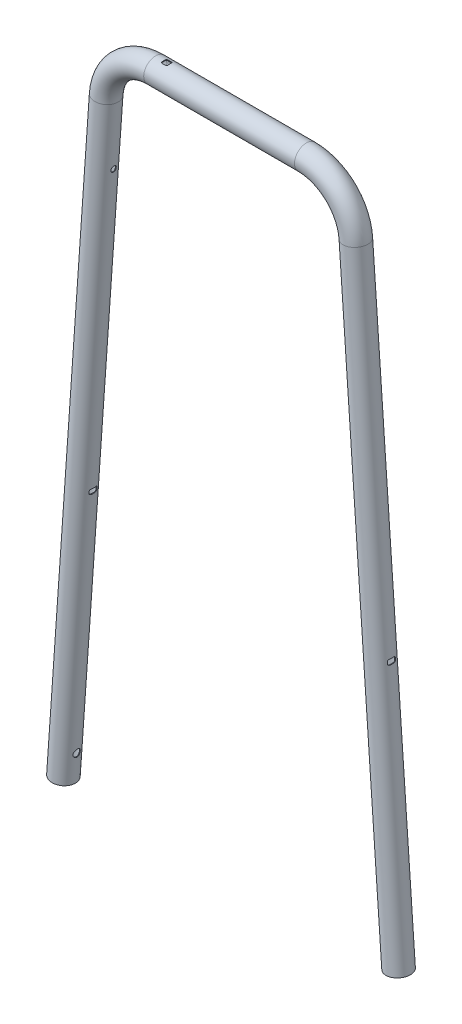
from build123d import *

# Parameters (mm, degrees)
SKETCH2_R                       = 13.2
SKETCH2_R_2                     = 12.4
SKETCH17_R                      = 4.05
CUT_EXTRUDE6_DEPTH              = 50
CUT_EXTRUDE7_DEPTH              = 50
SKETCH19_R                      = 4
CUT_EXTRUDE8_DEPTH              = 50
SKETCH20_R                      = 3.25
CUT_EXTRUDE9_DEPTH              = 50
CUT_EXTRUDE10_DEPTH             = 10
CUT_EXTRUDE11_REACH             = 838.488
SKETCH22_R                      = 3.05
CUT_EXTRUDE11_DIRECTION_2_REACH = 838.488


with BuildPart() as part:
    # Sweep2: sweep along a path in Sketch1
    with BuildLine(Plane.XY) as sweep2_path:
        Line((185.919930924, -162.284032228), (138.5, 515.852573828))
        ThreePointArc((138.5, 515.852573828), (121.143887039, 552.240421361), (83.633977236, 567.015967772))
        Line((83.633977236, 567.015967772), (-83.633977236, 567.015967772))
        ThreePointArc((-83.633977236, 567.015967772), (-121.143887039, 552.240421361), (-138.5, 515.852573828))
        Line((-138.5, 515.852573828), (-185.919930924, -162.284032228))
    # Sketch2 → Sweep2 (sweep)
    with BuildSketch(Plane(origin=(-185.919930924, -162.284032228, 0), x_dir=(-0.9975640502598243, 0.06975647374412519, 0), z_dir=(-0.06975647374412518, -0.9975640502598242, 0))):
        Circle(SKETCH2_R)
        Circle(SKETCH2_R_2, mode=Mode.SUBTRACT)
    sweep(path=sweep2_path.line)

    # Sketch17 → Cut-Extrude6 (cut)
    with BuildSketch(Plane(origin=(-185.919930924, -162.284032228, 0), x_dir=(0, 0, 1), z_dir=(-0.9975640502598242, 0.06975647374412637, 0))):
        with Locations((0, 30)):
            Circle(SKETCH17_R)
    cut_extrude6 = extrude(amount=-CUT_EXTRUDE6_DEPTH, mode=Mode.SUBTRACT)

    # Sketch18 → Cut-Extrude7 (cut, symmetric)
    with BuildSketch(Plane(origin=(-185.919930924, -162.284032228, 0), x_dir=(0, 0, 1), z_dir=(-0.9975640502598242, 0.06975647374412637, 0))):
        with BuildLine():
            Line((-2.5, 294.75), (2.5, 294.75))
            ThreePointArc((2.5, 294.75), (3.914213562, 294.164213562), (4.5, 292.75))
            Line((4.5, 292.75), (4.5, 291.25))
            ThreePointArc((4.5, 291.25), (3.914213562, 289.835786438), (2.5, 289.25))
            Line((2.5, 289.25), (-2.5, 289.25))
            ThreePointArc((-2.5, 289.25), (-3.914213562, 289.835786438), (-4.5, 291.25))
            Line((-4.5, 291.25), (-4.5, 292.75))
            ThreePointArc((-4.5, 292.75), (-3.914213562, 294.164213562), (-2.5, 294.75))
        make_face()
    cut_extrude7 = extrude(amount=CUT_EXTRUDE7_DEPTH, both=True, mode=Mode.SUBTRACT)

    # Mirror2: Cut-Extrude6, Cut-Extrude7 across plane
    add(cut_extrude6.mirror(Plane(origin=(0, 0, 0), x_dir=(0, 0, 1), z_dir=(1, 0, 0))), mode=Mode.SUBTRACT)
    add(cut_extrude7.mirror(Plane(origin=(0, 0, 0), x_dir=(0, 0, 1), z_dir=(1, 0, 0))), mode=Mode.SUBTRACT)

    # Sketch19 → Cut-Extrude8 (cut)
    with BuildSketch(Plane(origin=(-185.919930924, -162.284032228, 0), x_dir=(0, 0, 1), z_dir=(-0.9975640502598242, 0.06975647374412637, 0))):
        with Locations((0, 513)):
            Circle(SKETCH19_R)
    extrude(amount=CUT_EXTRUDE8_DEPTH, mode=Mode.SUBTRACT)

    # Sketch20 → Cut-Extrude9 (cut)
    with BuildSketch(Plane(origin=(0, 580.215967772, 0), x_dir=(1, 0, 0), z_dir=(0, 1, 0))):
        with Locations((-71.2, 0)):
            Circle(SKETCH20_R)
    extrude(amount=-CUT_EXTRUDE9_DEPTH, mode=Mode.SUBTRACT)

    # Sketch21 → Cut-Extrude10 (cut)
    with BuildSketch(Plane(origin=(0, 580.215967772, 0), x_dir=(1, 0, 0), z_dir=(0, 1, 0))):
        with BuildLine():
            Line((-73.45, -3.25), (-68.95, -3.25))
            ThreePointArc((-68.95, -3.25), (-68.242893219, -2.957106781), (-67.95, -2.25))
            Line((-67.95, -2.25), (-67.95, 2.25))
            ThreePointArc((-67.95, 2.25), (-68.242893219, 2.957106781), (-68.95, 3.25))
            Line((-68.95, 3.25), (-73.45, 3.25))
            ThreePointArc((-73.45, 3.25), (-74.157106781, 2.957106781), (-74.45, 2.25))
            Line((-74.45, 2.25), (-74.45, -2.25))
            ThreePointArc((-74.45, -2.25), (-74.157106781, -2.957106781), (-73.45, -3.25))
        make_face()
    extrude(amount=-CUT_EXTRUDE10_DEPTH, mode=Mode.SUBTRACT)

    # Sketch22 → Cut-Extrude11 (cut, up to next)
    with BuildSketch(Plane(origin=(-185.919930924, -162.284032228, 0), x_dir=(0, 0, 1), z_dir=(-0.9975640502598242, 0.06975647374412637, 0)), mode=Mode.PRIVATE) as cut_extrude11_sk1:
        with Locations((0, 613)):
            Circle(SKETCH22_R)
    cut_extrude11_tool1 = extrude(cut_extrude11_sk1.sketch, amount=-CUT_EXTRUDE11_REACH, mode=Mode.PRIVATE) & part.part
    add(cut_extrude11_tool1.solids().sort_by_distance((-143.159213, 449.222731, 0))[0], mode=Mode.SUBTRACT)

    # Sketch22 → Cut-Extrude11 direction 2 (cut, up to next)
    with BuildSketch(Plane(origin=(-185.919930924, -162.284032228, 0), x_dir=(0, 0, 1), z_dir=(-0.9975640502598242, 0.06975647374412637, 0)), mode=Mode.PRIVATE) as cut_extrude11_direction_2_sk1:
        with Locations((0, 613)):
            Circle(SKETCH22_R)
    cut_extrude11_direction_2_tool1 = extrude(cut_extrude11_direction_2_sk1.sketch, amount=CUT_EXTRUDE11_DIRECTION_2_REACH, mode=Mode.PRIVATE) & part.part
    add(cut_extrude11_direction_2_tool1.solids().sort_by_distance((-143.159213, 449.222731, 0))[0], mode=Mode.SUBTRACT)


solid = part.part
